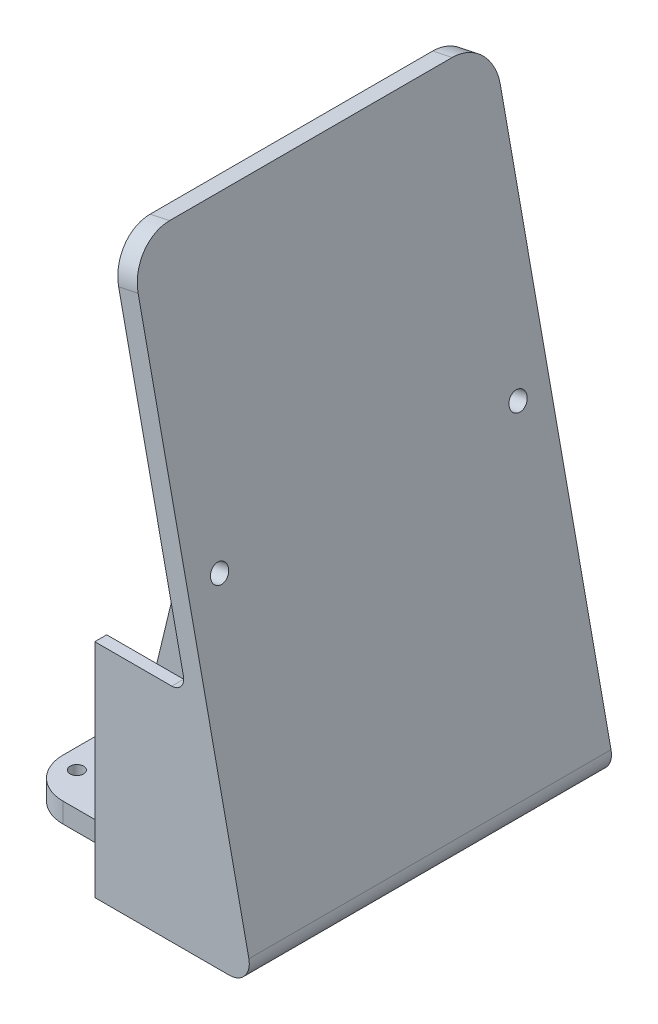
from build123d import *

# Parameters (mm, degrees)
EXTRUDE_1_DEPTH          = 85
SKETCH_3_R               = 2.2499999999999964
SKETCH_3_R_2             = 2.2500000000000018
CUT_EXTRUDE_1_DEPTH      = 19.999999999999996
EXTRUDE_2_DEPTH          = 3
EXTRUDE_3_DEPTH          = 3
FILLET_1_R               = 5
SKETCH_6_R               = 1.6999999999999973
SKETCH_6_R_2             = 1.7000000000000015
SKETCH_6_R_3             = 1.6999999999999984
SKETCH_6_R_4             = 1.6999999999999995
CUT_EXTRUDE_2_DEPTH      = 10
CUT_EXTRUDE_3_DEPTH      = 185.8550415825309
CUT_EXTRUDE_3_DEPTH_BACK = 185.8550415825309
SKETCH_8_W               = 29.999999999999993
SKETCH_8_H               = 12
SKETCH_8_H_2             = 12.000000000000002
CUT_EXTRUDE_4_DEPTH      = 150
EXTRUDE_4_DEPTH          = 5
FILLET_4_R               = 3
FILLET_5_R               = 10
FILLET_6_R               = 10


with BuildPart() as part:
    # 草图2 → 凸台-拉伸1 (new body)
    with BuildSketch(Plane.XY):
        Polygon((0, 0), (-31.18675362266453, 146.7221401100707), (-36.07749162633355, 145.6825816559819), (-6.174485782675303, 5), (-70, 4.999999999999992), (-70, 0), align=None)
    extrude(amount=EXTRUDE_1_DEPTH)

    # 草图3 → 切除-拉伸1 (cut)
    with BuildSketch(Plane(origin=(0, 0, 0), x_dir=(0, 0, -1), z_dir=(0.9781476007338048, 0.20791169081776356, 0))):
        with Locations(Location((-79.99999999999997, 79.99999999999996, 0), (0, 0, 90))):
            Circle(SKETCH_3_R)
        with Locations(Location((-4.999999999999984, 79.99999999999996, 0), (0, 0, 90))):
            Circle(SKETCH_3_R_2)
    extrude(amount=-CUT_EXTRUDE_1_DEPTH, mode=Mode.SUBTRACT)

    # 草图4 → 凸台-拉伸2 (add)
    with BuildSketch(Plane.XY.offset(85)):
        Polygon((-36.07749162633355, 145.6825816559819), (-70, 4.999999999999992), (-70, 0), (0, 0), (-31.18675362266453, 146.7221401100707), align=None)
    extrude(amount=EXTRUDE_2_DEPTH)

    # 草图5 → 凸台-拉伸3 (add)
    with BuildSketch(Plane(origin=(0, 0, 0), x_dir=(-1, 0, 0), z_dir=(0, 0, -1))):
        Polygon((36.07749162633355, 145.6825816559819), (31.18675362266453, 146.7221401100707), (0, 0), (70, 0), (70, 4.999999999999992), align=None)
    extrude(amount=EXTRUDE_3_DEPTH)

    # 圆角1
    fillet_1_edges = [part.edges().sort_by_distance(p)[0] for p in [
        (0, 0, 42.5),
    ]]
    fillet(fillet_1_edges, radius=FILLET_1_R)

    # 草图6 → 切除-拉伸2 (cut)
    with BuildSketch(Plane.XZ):
        with Locations(Location((-65, 67.5, 0), (0, 0, 270))):
            Circle(SKETCH_6_R)
        with Locations(Location((-34.99999999999999, 67.5, 0), (0, 0, 270))):
            Circle(SKETCH_6_R_2)
        with Locations(Location((-65.00000000000001, 17.5, 0), (0, 0, 270))):
            Circle(SKETCH_6_R_3)
        with Locations(Location((-34.999999999999986, 17.5, 0), (0, 0, 270))):
            Circle(SKETCH_6_R_4)
    extrude(amount=-CUT_EXTRUDE_2_DEPTH, mode=Mode.SUBTRACT)

    # 草图7 → 切除-拉伸3 (cut, two sides: drawn at the far end of the back side and taken through both)
    with BuildSketch(Plane.XY.offset(-CUT_EXTRUDE_3_DEPTH_BACK)):
        Polygon((-36.07749162633355, 145.6825816559819), (-16.94740107603117, 55.68258165598189), (-57.7790108740802, 55.682581655981885), align=None)
    extrude(amount=CUT_EXTRUDE_3_DEPTH + CUT_EXTRUDE_3_DEPTH_BACK, mode=Mode.SUBTRACT)

    # 草图8 → 切除-拉伸4 (cut)
    with BuildSketch(Plane.XZ):
        with Locations((-55, 82.00000000000001)):
            Rectangle(SKETCH_8_W, SKETCH_8_H)
        with Locations((-55, 3.000000000000001)):
            Rectangle(SKETCH_8_W, SKETCH_8_H_2)
    extrude(amount=-CUT_EXTRUDE_4_DEPTH, mode=Mode.SUBTRACT)

    # 草图9 → 凸台-拉伸4 (add)
    with BuildSketch(Plane.XY.offset(45.000000000000014)):
        Polygon((-36.077491626333554, 145.6825816559819), (-70, 5), (-6.174485782675303, 5), align=None)
    extrude(amount=-EXTRUDE_4_DEPTH)

    # 圆角4
    fillet_4_edges = [part.edges().sort_by_distance(p)[0] for p in [
        (-16.94740107603117, 55.68258165598189, -1.5),
        (-6.174485782675303, 5, 65),
        (-6.174485782675303, 5, 20.000000000000007),
        (-21.125988704504426, 75.34129082799095, 40.000000000000014),
        (-38.08724289133765, 5, 40.000000000000014),
        (-21.125988704504426, 75.34129082799095, 45.000000000000014),
        (-38.08724289133765, 5, 45.000000000000014),
        (-23.087242891337652, 4.999999999999998, 85),
        (-23.087242891337652, 4.999999999999998, 0),
        (-11.560943429353237, 30.34129082799096, 0),
        (-11.560943429353237, 30.34129082799096, 85),
        (-16.94740107603117, 55.68258165598189, 86.5),
    ]]
    fillet(fillet_4_edges, radius=FILLET_4_R)

    # 圆角5
    fillet_5_edges = [part.edges().sort_by_distance(p)[0] for p in [
        (-70, 2.499999999999996, 9.000000000000002),
        (-70, 2.499999999999996, 76.00000000000001),
        (-40.00000000000001, 2.499999999999998, 76.00000000000001),
        (-40.00000000000001, 2.499999999999998, 9.000000000000002),
    ]]
    fillet(fillet_5_edges, radius=FILLET_5_R)

    # 圆角6
    fillet_6_edges = [part.edges().sort_by_distance(p)[0] for p in [
        (-33.63212262449904, 146.2023608830263, 88),
        (-33.63212262449904, 146.2023608830263, -3),
    ]]
    fillet(fillet_6_edges, radius=FILLET_6_R)


solid = part.part
